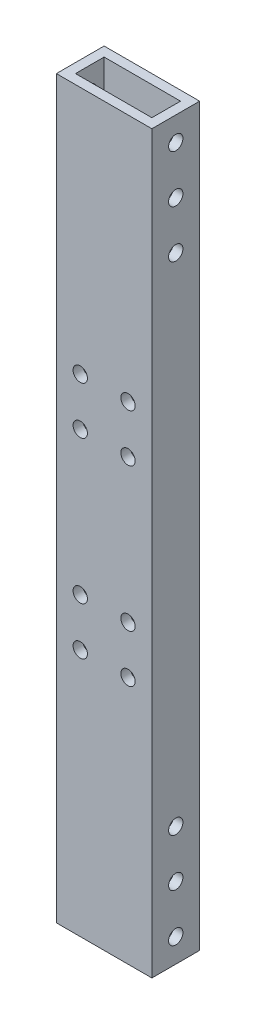
from build123d import *

# Parameters (mm, degrees)
SKETCH_1_W          = 20
SKETCH_1_H          = 10
SKETCH_1_W_2        = 16
SKETCH_1_H_2        = 6
EXTRUDE_1_DEPTH     = 77
SKETCH_2_R          = 1.5
CUT_EXTRUDE_1_DEPTH = 80.711981534
SKETCH_3_R          = 1.5
CUT_EXTRUDE_2_DEPTH = 79.287930104


with BuildPart() as part:
    # 草图1 → 凸台-拉伸1 (new, symmetric)
    with BuildSketch(Plane(origin=(0, 0, 0), x_dir=(1, 0, 0), z_dir=(0, 1, 0))):
        Rectangle(SKETCH_1_W, SKETCH_1_H)
        Rectangle(SKETCH_1_W_2, SKETCH_1_H_2, mode=Mode.SUBTRACT)
    extrude(amount=EXTRUDE_1_DEPTH, both=True)

    # 草图2 → 切除-拉伸1 (cut, through all)
    with BuildSketch(Plane(origin=(10, 0, 0), x_dir=(0, 0, -1), z_dir=(1, 0, 0))):
        with Locations((0, 52)):
            Circle(SKETCH_2_R)
        with Locations((0, 72)):
            Circle(SKETCH_2_R)
        with Locations((0, 62)):
            Circle(SKETCH_2_R)
        with Locations((0, -72)):
            Circle(SKETCH_2_R)
        with Locations((0, -62)):
            Circle(SKETCH_2_R)
        with Locations((0, -52)):
            Circle(SKETCH_2_R)
    extrude(amount=-CUT_EXTRUDE_1_DEPTH, mode=Mode.SUBTRACT)

    # 草图3 → 切除-拉伸2 (cut, through all)
    with BuildSketch(Plane(origin=(0, 0, -5), x_dir=(-1, 0, 0), z_dir=(0, 0, -1))):
        with Locations((5, -15)):
            Circle(SKETCH_3_R)
        with Locations((-5, -15)):
            Circle(SKETCH_3_R)
        with Locations((-5, -25)):
            Circle(SKETCH_3_R)
        with Locations((5, -25)):
            Circle(SKETCH_3_R)
        with Locations((-5, 25)):
            Circle(SKETCH_3_R)
        with Locations((5, 25)):
            Circle(SKETCH_3_R)
        with Locations((5, 15)):
            Circle(SKETCH_3_R)
        with Locations((-5, 15)):
            Circle(SKETCH_3_R)
    extrude(amount=-CUT_EXTRUDE_2_DEPTH, mode=Mode.SUBTRACT)


solid = part.part
